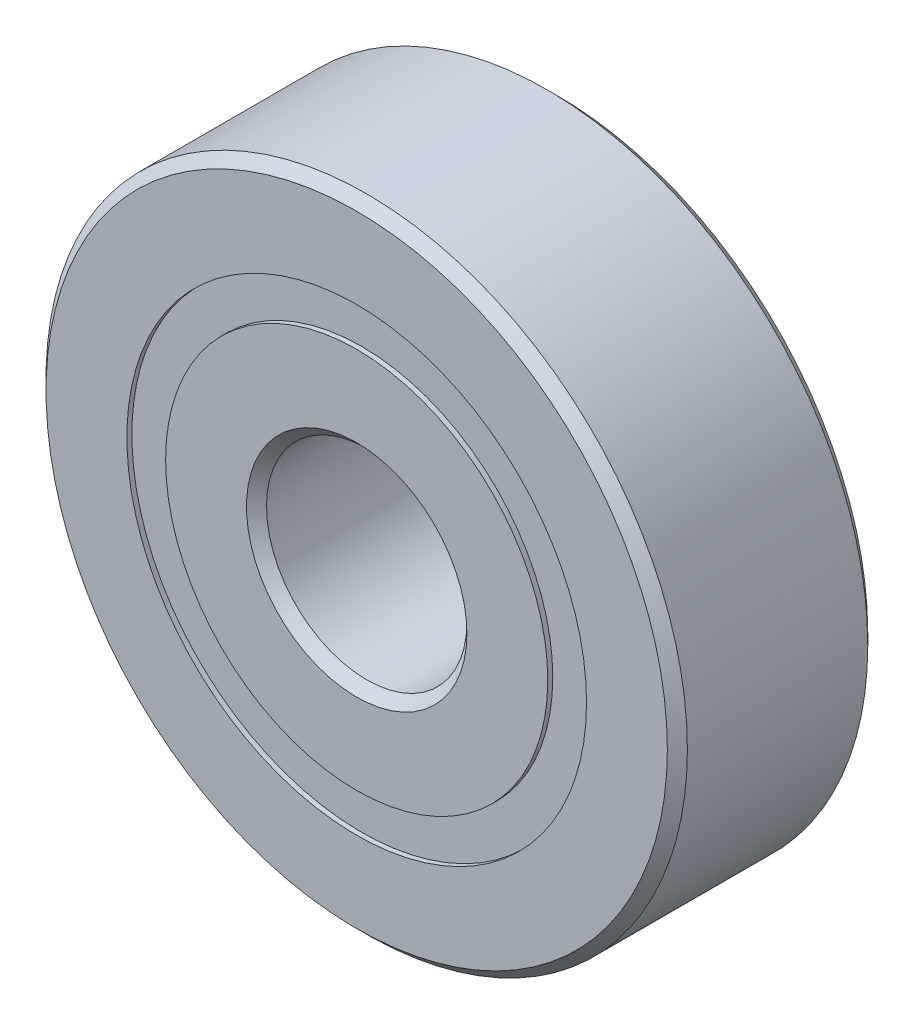
from build123d import *

# Parameters (mm, degrees)
CIRPATTERN1_COUNT = 10
SKETCH5_W         = 1.163242561
SKETCH5_H         = 0.967032968


with BuildPart() as part:
    # Sketch1 → Revolve1 (revolve)
    with BuildSketch(Plane(origin=(0, 0, 0), x_dir=(0, 0, -1), z_dir=(1, 0, 0))):
        with BuildLine():
            Line((2.25, 8), (-2.25, 8))
            Line((-2.25, 8), (-2.5, 7.75))
            Line((-2.5, 7.75), (-2.5, 5.733516484))
            Line((-2.5, 5.733516484), (-1.111111111, 5.733516484))
            ThreePointArc((-1.111111111, 5.733516484), (0, 6.461757439), (1.111111111, 5.733516484))
            Line((1.111111111, 5.733516484), (2.5, 5.733516484))
            Line((2.5, 5.733516484), (2.5, 7.75))
            Line((2.5, 7.75), (2.25, 8))
        make_face()
    revolve(axis=Axis((0, 0, 2.5), (0, 0, -1)))


with BuildPart() as body_2:
    # Sketch3 → Revolve3 (revolve)
    with BuildSketch(Plane(origin=(0, 0, 0), x_dir=(0, 0, -1), z_dir=(1, 0, 0))):
        with BuildLine():
            Line((-2.5, 4.766483516), (-1.111111111, 4.766483516))
            ThreePointArc((-1.111111111, 4.766483516), (0, 4.038242561), (1.111111111, 4.766483516))
            Line((1.111111111, 4.766483516), (2.5, 4.766483516))
            Line((2.5, 4.766483516), (2.5, 2.75))
            Line((2.5, 2.75), (2.25, 2.5))
            Line((2.25, 2.5), (-2.25, 2.5))
            Line((-2.25, 2.5), (-2.5, 2.75))
            Line((-2.5, 2.75), (-2.5, 4.766483516))
        make_face()
    revolve(axis=Axis((0, 0, 2.5), (0, 0, -1)))


with BuildPart() as body_3:
    # Sketch4 → Revolve4 (revolve)
    with BuildSketch(Plane(origin=(0, 0, 0), x_dir=(0, 0, -1), z_dir=(1, 0, 0))):
        with BuildLine():
            Line((-1.211757439, 5.25), (1.211757439, 5.25))
            ThreePointArc((1.211757439, 5.25), (0, 6.461757439), (-1.211757439, 5.25))
        make_face()
    revolve(axis=Axis((0, 5.25, 1.211757439), (0, 0, -1)))


with BuildPart() as cirpattern1_1:
    # CirPattern1: pattern copy
    add(body_3.part.rotate(Axis((0, 0, -2.5), (0, 0, 1)), 1 * 360 / CIRPATTERN1_COUNT))


with BuildPart() as cirpattern1_2:
    # CirPattern1: pattern copy
    add(body_3.part.rotate(Axis((0, 0, -2.5), (0, 0, 1)), 2 * 360 / CIRPATTERN1_COUNT))


with BuildPart() as cirpattern1_3:
    # CirPattern1: pattern copy
    add(body_3.part.rotate(Axis((0, 0, -2.5), (0, 0, 1)), 3 * 360 / CIRPATTERN1_COUNT))


with BuildPart() as cirpattern1_4:
    # CirPattern1: pattern copy
    add(body_3.part.rotate(Axis((0, 0, -2.5), (0, 0, 1)), 4 * 360 / CIRPATTERN1_COUNT))


with BuildPart() as cirpattern1_5:
    # CirPattern1: pattern copy
    add(body_3.part.rotate(Axis((0, 0, -2.5), (0, 0, 1)), 5 * 360 / CIRPATTERN1_COUNT))


with BuildPart() as cirpattern1_6:
    # CirPattern1: pattern copy
    add(body_3.part.rotate(Axis((0, 0, -2.5), (0, 0, 1)), 6 * 360 / CIRPATTERN1_COUNT))


with BuildPart() as cirpattern1_7:
    # CirPattern1: pattern copy
    add(body_3.part.rotate(Axis((0, 0, -2.5), (0, 0, 1)), 7 * 360 / CIRPATTERN1_COUNT))


with BuildPart() as cirpattern1_8:
    # CirPattern1: pattern copy
    add(body_3.part.rotate(Axis((0, 0, -2.5), (0, 0, 1)), 8 * 360 / CIRPATTERN1_COUNT))


with BuildPart() as cirpattern1_9:
    # CirPattern1: pattern copy
    add(body_3.part.rotate(Axis((0, 0, -2.5), (0, 0, 1)), 9 * 360 / CIRPATTERN1_COUNT))


with BuildPart() as body_13:
    # Sketch5 → Revolve5 (revolve)
    with BuildSketch(Plane(origin=(0, 0, 0), x_dir=(0, 0, -1), z_dir=(1, 0, 0))):
        with Locations((-1.79337872, 5.25)):
            Rectangle(SKETCH5_W, SKETCH5_H)
        with Locations((1.79337872, 5.25)):
            Rectangle(SKETCH5_W, SKETCH5_H)
    revolve(axis=Axis((0, 0, 2.5), (0, 0, -1)))


solid = Compound([part.part, body_2.part, body_3.part, cirpattern1_1.part, cirpattern1_2.part, cirpattern1_3.part, cirpattern1_4.part, cirpattern1_5.part, cirpattern1_6.part, cirpattern1_7.part, cirpattern1_8.part, cirpattern1_9.part, body_13.part])
